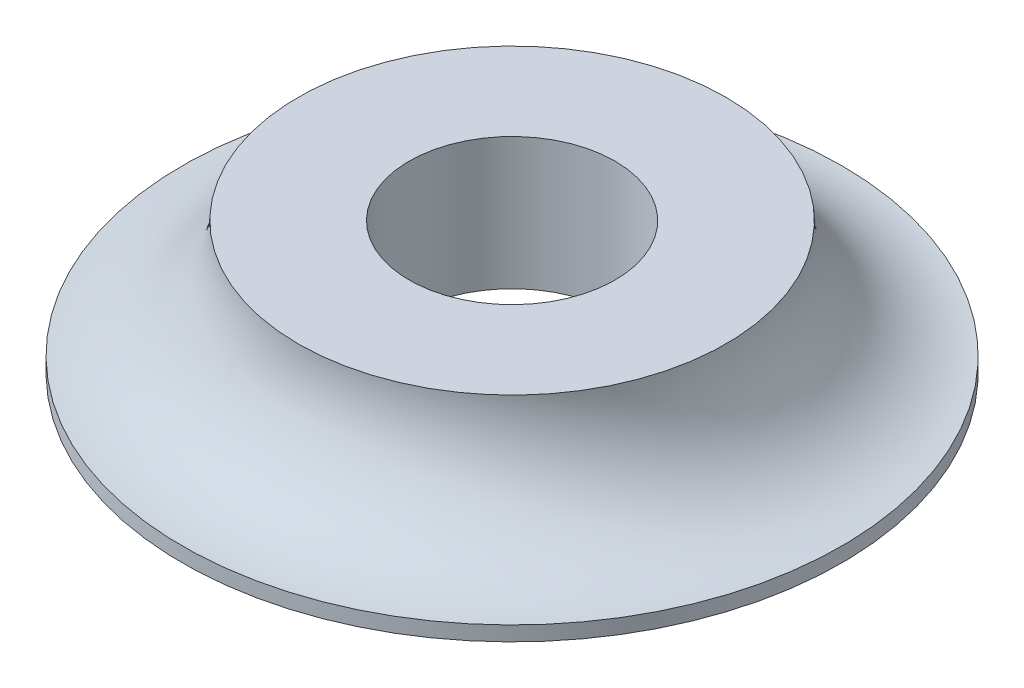
from build123d import *


with BuildPart() as part:
    # Sketch3 → Revolve1 (revolve)
    with BuildSketch(Plane.XY, mode=Mode.PRIVATE) as revolve1_sk:
        with BuildLine():
            Line((3.96875, 0), (12.7, 0))
            Line((12.7, 0), (12.7, 0.565718663))
            ThreePointArc((12.7, 0.565718663), (9.533575757, 1.89854758), (8.237028069, 5.08))
            Line((8.237028069, 5.08), (3.96875, 5.08))
            Line((3.96875, 5.08), (3.96875, 0))
        make_face()
    revolve(revolve1_sk.sketch.rotate(Axis((0, 0, 0), (0, 1, 0)), 90), axis=Axis((0, 0, 0), (0, 1, 0)))


solid = part.part
